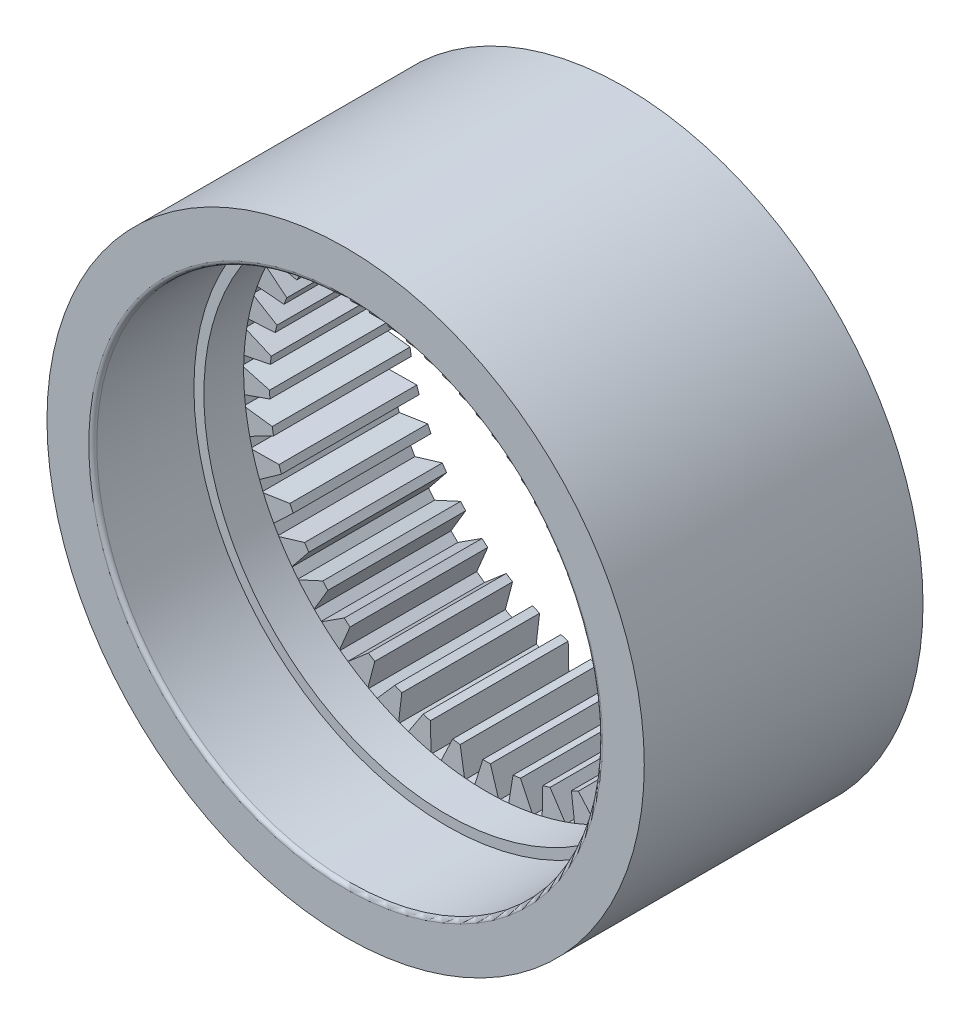
from build123d import *

# Parameters (mm, degrees)
ESQUISSE1_R                  = 75
BOSS_EXTRU_1_DEPTH           = 70
ESQUISSE2_R                  = 63.5
ENL_V_MAT_EXTRU_1_DEPTH      = 25.4
ESQUISSE3_R                  = 54.5
ENL_V_MAT_EXTRU_3_DEPTH      = 116.061548747
ENL_V_START                  = -10
ENL_V_MAT_EXTRU_4_DEPTH      = 70
R_P_TITION_CIRCULAIRE1_COUNT = 45
ENL_V_START_2                = -25.4
ESQUISSE5_R                  = 61
ENL_V_MAT_EXTRU_5_DEPTH      = 10
CONG_1_R                     = 1


with BuildPart() as part:
    # Esquisse1 → Boss.-Extru.1 (new body)
    with BuildSketch(Plane.XY):
        Circle(ESQUISSE1_R)
    extrude(amount=BOSS_EXTRU_1_DEPTH)

    # Esquisse2 → Enlèv. mat.-Extru.1 (cut)
    with BuildSketch(Plane.XY.offset(70)):
        Circle(ESQUISSE2_R)
    extrude(amount=-ENL_V_MAT_EXTRU_1_DEPTH, mode=Mode.SUBTRACT)

    # Esquisse3 → Enlèv. mat.-Extru.3 (cut, through all)
    with BuildSketch(Plane.XY.offset(44.6)):
        Circle(ESQUISSE3_R)
    extrude(amount=-ENL_V_MAT_EXTRU_3_DEPTH, mode=Mode.SUBTRACT)

    # Esquisse4 → Enlèv. mat.-Extru.4 (cut)
    with BuildSketch(Plane.XY.offset(44.6).offset(ENL_V_START)):
        Polygon((0, 0), (-2.852309615, 54.425309644), (-1.2, 61.425309644), (1.2, 61.425309644), (2.852309615, 54.425309644), align=None)
    enl_v_mat_extru_4 = extrude(amount=-ENL_V_MAT_EXTRU_4_DEPTH, mode=Mode.SUBTRACT)

    # Répétition circulaire1: Enlèv. mat.-Extru.4 ×45 about axis
    r_p_tition_circulaire1_axis = Axis((0, 0, 70), (0, 0, -1))
    for i in range(1, R_P_TITION_CIRCULAIRE1_COUNT):
        add(enl_v_mat_extru_4.rotate(r_p_tition_circulaire1_axis, i * 360 / R_P_TITION_CIRCULAIRE1_COUNT), mode=Mode.SUBTRACT)

    # Esquisse5 → Enlèv. mat.-Extru.5 (cut)
    with BuildSketch(Plane.XY.offset(70).offset(ENL_V_START_2)):
        Circle(ESQUISSE5_R)
    extrude(amount=-ENL_V_MAT_EXTRU_5_DEPTH, mode=Mode.SUBTRACT)

    # Congé1
    cong_1_edges = [part.edges().sort_by_distance(p)[0] for p in [
        (-63.5, 0, 70),
    ]]
    fillet(cong_1_edges, radius=CONG_1_R)


solid = part.part
